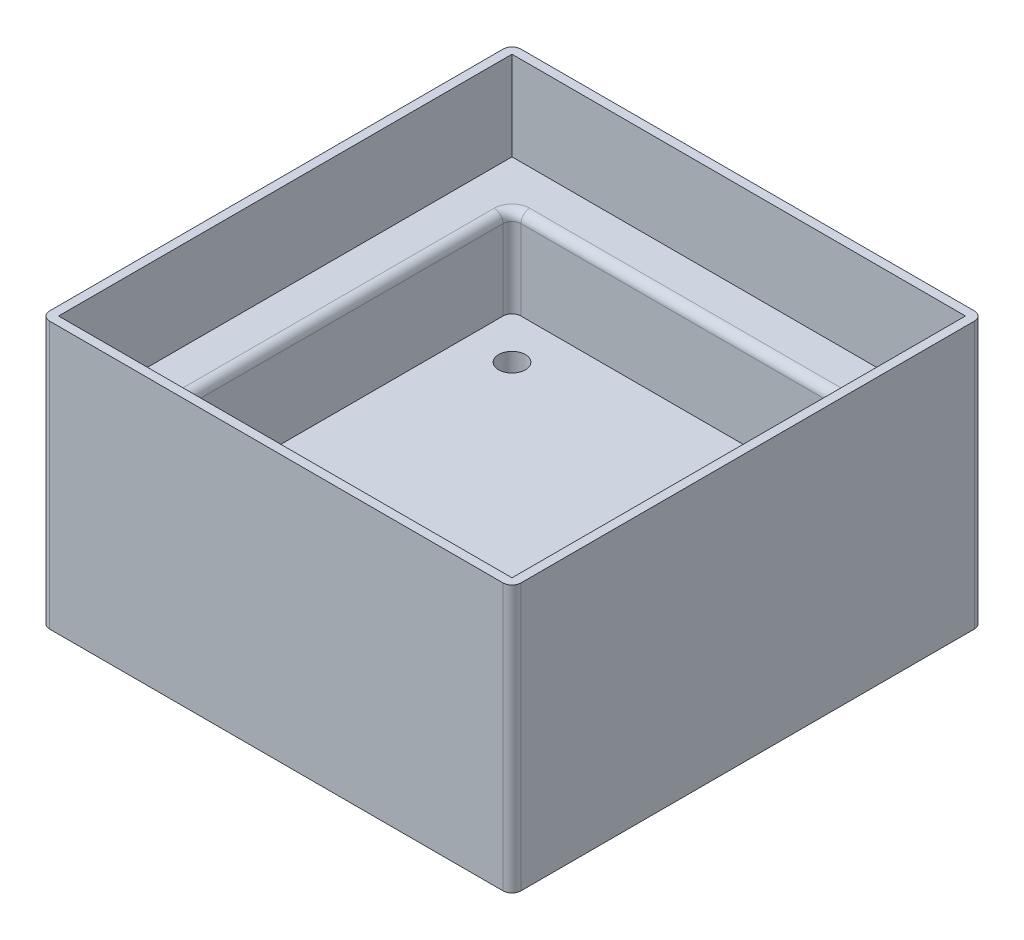
from build123d import *

# Parameters (mm, degrees)
SKETCH1_W           = 53
SKETCH1_H           = 53
BOSS_EXTRUDE1_DEPTH = 30
SKETCH6_W           = 51
SKETCH6_H           = 51
CUT_EXTRUDE1_DEPTH  = 10
SKETCH7_W           = 41
SKETCH7_H           = 41
CUT_EXTRUDE2_DEPTH  = 10
SKETCH14_R          = 1.5
CUT_EXTRUDE4_DEPTH  = 78.575769413
FILLET1_R           = 1


with BuildPart() as part:
    # Sketch1 → Boss-Extrude1 (new body)
    with BuildSketch(Plane(origin=(0, 0, 0), x_dir=(1, 0, 0), z_dir=(0, 1, 0))):
        with Locations((26.5, -26.5)):
            Rectangle(SKETCH1_W, SKETCH1_H)
    extrude(amount=BOSS_EXTRUDE1_DEPTH)

    # Sketch6 → Cut-Extrude1 (cut)
    with BuildSketch(Plane(origin=(0, 30, 0), x_dir=(1, 0, 0), z_dir=(0, 1, 0))):
        with Locations((26.5, -26.5)):
            Rectangle(SKETCH6_W, SKETCH6_H)
    extrude(amount=-CUT_EXTRUDE1_DEPTH, mode=Mode.SUBTRACT)

    # Sketch7 → Cut-Extrude2 (cut)
    with BuildSketch(Plane(origin=(0, 20, 0), x_dir=(1, 0, 0), z_dir=(0, 1, 0))):
        with Locations((26.5, -26.5)):
            Rectangle(SKETCH7_W, SKETCH7_H)
    extrude(amount=-CUT_EXTRUDE2_DEPTH, mode=Mode.SUBTRACT)

    # Sketch14 → Cut-Extrude4 (cut, through all)
    with BuildSketch(Plane(origin=(0, 10, 0), x_dir=(1, 0, 0), z_dir=(0, 1, 0))):
        with Locations(Location((11, -11, 0), (0, 0, 270))):
            Circle(SKETCH14_R)
        with Locations(Location((42, -11, 0), (0, 0, 270))):
            Circle(SKETCH14_R)
        with Locations(Location((42, -42, 0), (0, 0, 270))):
            Circle(SKETCH14_R)
        with Locations(Location((11, -42, 0), (0, 0, 270))):
            Circle(SKETCH14_R)
    extrude(amount=-CUT_EXTRUDE4_DEPTH, mode=Mode.SUBTRACT)

    # Fillet1
    fillet1_edges = [part.edges().sort_by_distance(p)[0] for p in [
        (6, 15, 6),
        (47, 15, 6),
        (47, 15, 47),
        (6, 15, 47),
        (26.5, 20, 6),
        (6, 20, 26.5),
        (26.5, 20, 47),
        (47, 20, 26.5),
        (0, 15, 0),
        (53, 15, 0),
        (53, 15, 53),
        (0, 15, 53),
    ]]
    fillet(fillet1_edges, radius=FILLET1_R)


solid = part.part
